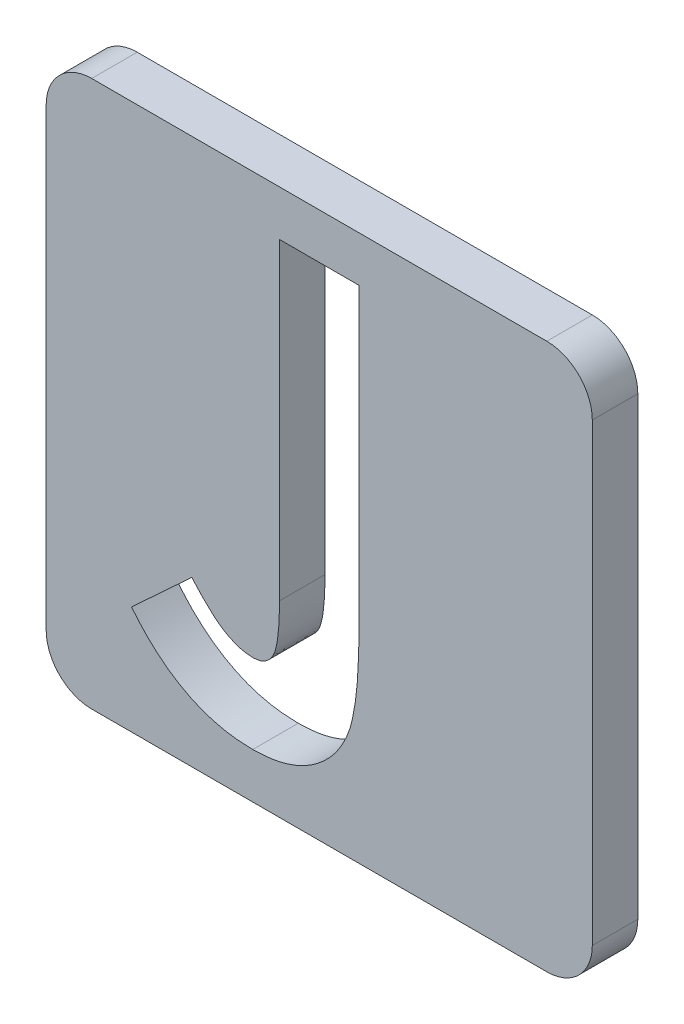
from build123d import *

# Parameters (mm, degrees)
BOSS_EXTRUDE1_DEPTH = 10
CUT_EXTRUDE23_DEPTH = 10


with BuildPart() as part:
    # Sketch1 → Boss-Extrude1 (new body)
    with BuildSketch(Plane.XY):
        with BuildLine():
            Line((-50, 60), (50, 60))
            ThreePointArc((50, 60), (57.071067812, 57.071067812), (60, 50))
            Line((60, 50), (60, -50))
            ThreePointArc((60, -50), (57.071067812, -57.071067812), (50, -60))
            Line((50, -60), (-50, -60))
            ThreePointArc((-50, -60), (-57.071067812, -57.071067812), (-60, -50))
            Line((-60, -50), (-60, 50))
            ThreePointArc((-60, 50), (-57.071067812, 57.071067812), (-50, 60))
        make_face()
    extrude(amount=BOSS_EXTRUDE1_DEPTH)

    # Sketch2 → Cut-Extrude23 (cut)
    with BuildSketch(Plane.XY.offset(10)):
        with BuildLine():
            Line((-8.75, 50), (8.75, 50))
            Line((8.75, 50), (8.75, -14.7265625))
            add(Edge.make_bspline(
                [(8.75, -14.7265625), (8.743583975, -15.963662149), (8.731221561, -18.347308928), (8.60745187, -21.778880386), (8.440093422, -24.925119282), (8.199081109, -27.780984325), (7.841111838, -30.346337414), (7.435999316, -32.627578869), (6.989047753, -34.634004111), (6.23403689, -36.879506107), (5.061904404, -39.366144137), (3.293123023, -42.05206658), (1.090424054, -44.385675502), (-1.446357574, -46.412684578), (-4.338596124, -48.017692334), (-7.51966122, -49.177796237), (-10.979383755, -49.870850344), (-13.375676653, -49.956106859), (-14.609375, -50)],
                knots=[0, 0, 0, 0, 1.22248561, 2.355488409, 3.392943897, 4.335991845, 5.186735882, 5.951517034, 6.625683685, 7.215700098, 8.28923535, 9.333114649, 10.380102123, 11.447198135, 12.530158036, 13.633358744, 14.781567393, 16, 16, 16, 16], degree=3))
            add(Edge.make_bspline(
                [(-14.609375, -50), (-15.894776413, -49.960205451), (-18.430089946, -49.88171506), (-22.148388349, -49.2131785), (-25.722137923, -48.141313235), (-29.13284997, -46.591524706), (-32.427252281, -44.650205179), (-35.545554474, -42.242187263), (-38.552862415, -39.442154155), (-40.33561292, -37.293479019), (-41.25, -36.19140625)],
                knots=[0, 0, 0, 0, 0.990984786, 1.954608977, 2.90473533, 3.862451285, 4.837525908, 5.848096122, 6.896271184, 8, 8, 8, 8], degree=3))
            Line((-41.25, -36.19140625), (-28.0078125, -23.9453125))
            add(Edge.make_bspline(
                [(-28.0078125, -23.9453125), (-27.314466509, -24.729291012), (-26.01702976, -26.196325573), (-24.061830829, -28.109374669), (-22.298136041, -29.64628881), (-20.635555645, -30.75487882), (-19.06661841, -31.53631102), (-17.557567552, -32.099198603), (-16.061363785, -32.417824942), (-15.072925956, -32.473022924), (-14.58984375, -32.5)],
                knots=[0, 0, 0, 0, 1.529509877, 2.862124173, 3.996688592, 4.944357383, 5.774364335, 6.554177287, 7.293378699, 8, 8, 8, 8], degree=3))
            add(Edge.make_bspline(
                [(-14.58984375, -32.5), (-14.122273945, -32.475616988), (-13.223290925, -32.428736471), (-11.987154797, -31.907600104), (-10.945012492, -31.089394098), (-10.25892751, -30.148760123), (-9.821709802, -29.187178965), (-9.548527937, -28.257662954), (-9.289277875, -27.143425185), (-9.081572506, -25.845024103), (-8.924629957, -24.345523841), (-8.846405442, -22.663128248), (-8.751274399, -20.78874592), (-8.750439906, -19.479327194), (-8.75, -18.7890625)],
                knots=[0, 0, 0, 0, 1.003927327, 1.930222208, 2.840933547, 3.835773585, 4.407906147, 5.114514582, 5.922289074, 6.876303333, 7.950072246, 9.174518422, 10.510537432, 12, 12, 12, 12], degree=3))
            Line((-8.75, -18.7890625), (-8.75, 50))
        make_face()
    extrude(amount=-CUT_EXTRUDE23_DEPTH, mode=Mode.SUBTRACT)


solid = part.part
